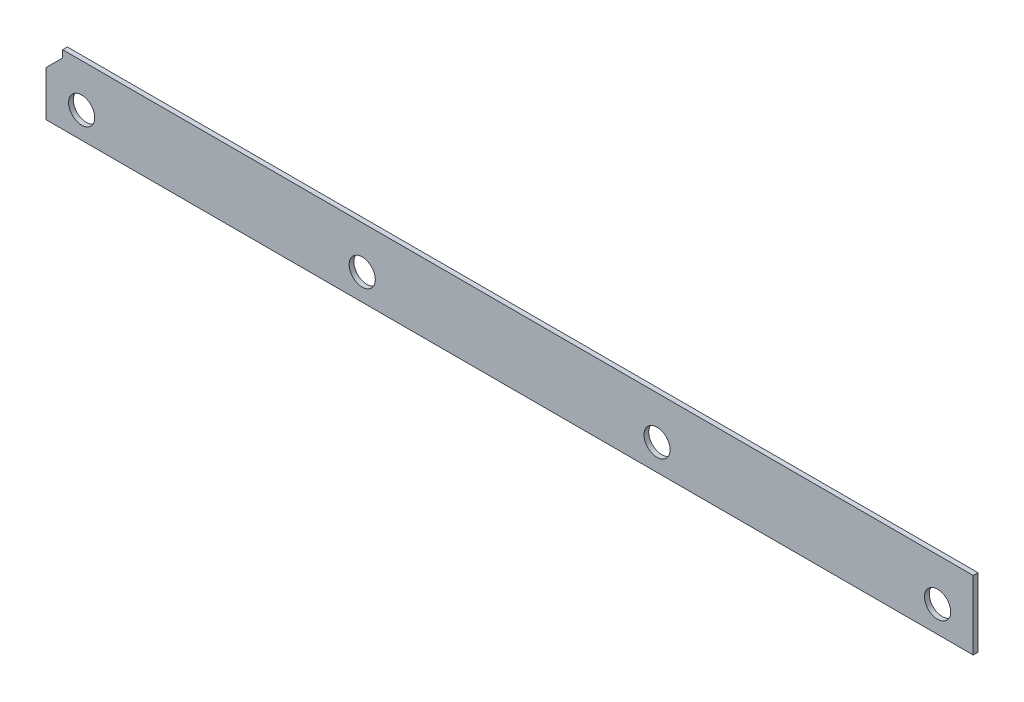
from build123d import *

# Parameters (mm, degrees)
WIDE_FLANGE_WITH_ORIGINAL_FLOOR_BOLT_2_R       = 2.75
WIDE_FLANGE_WITH_ORIGINAL_FLOOR_BOLT_CEN_DEPTH = 1


with BuildPart() as part:
    # Wide flange with original floor bolt 2 → Wide flange with original floor bolt cen (new body)
    with BuildSketch(Plane.XY):
        Polygon((97.5, -14.5), (-97.5, -14.5), (-97.5, -5), (-94, -1.5), (-94, 0), (97.5, 0), align=None)
        with Locations((90, -9)):
            Circle(WIDE_FLANGE_WITH_ORIGINAL_FLOOR_BOLT_2_R, mode=Mode.SUBTRACT)
        with Locations((31, -9)):
            Circle(WIDE_FLANGE_WITH_ORIGINAL_FLOOR_BOLT_2_R, mode=Mode.SUBTRACT)
        with Locations((-31, -9)):
            Circle(WIDE_FLANGE_WITH_ORIGINAL_FLOOR_BOLT_2_R, mode=Mode.SUBTRACT)
        with Locations((-90, -9)):
            Circle(WIDE_FLANGE_WITH_ORIGINAL_FLOOR_BOLT_2_R, mode=Mode.SUBTRACT)
    extrude(amount=WIDE_FLANGE_WITH_ORIGINAL_FLOOR_BOLT_CEN_DEPTH)


solid = part.part
